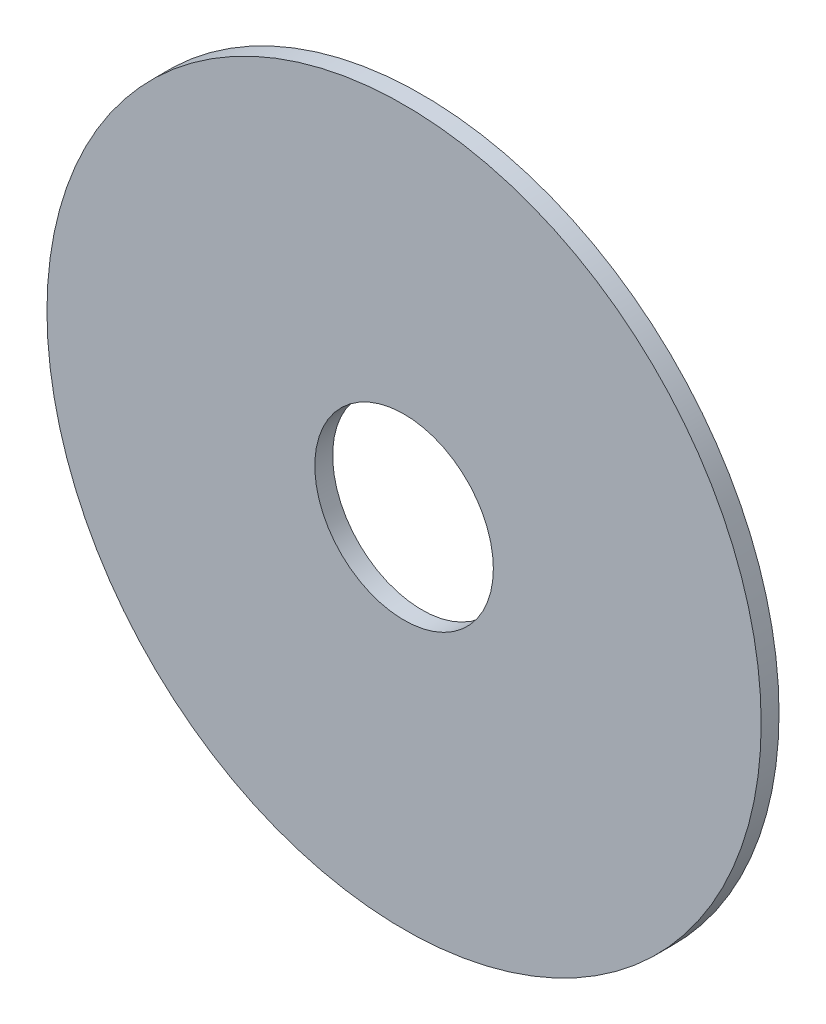
from build123d import *

# Parameters (mm, degrees)
SKETCH1_R           = 50
SKETCH1_R_2         = 12.5
BOSS_EXTRUDE1_DEPTH = 2.5


with BuildPart() as part:
    # Sketch1 → Boss-Extrude1 (new body)
    with BuildSketch(Plane.XY):
        Circle(SKETCH1_R)
        Circle(SKETCH1_R_2, mode=Mode.SUBTRACT)
    extrude(amount=BOSS_EXTRUDE1_DEPTH)


solid = part.part
